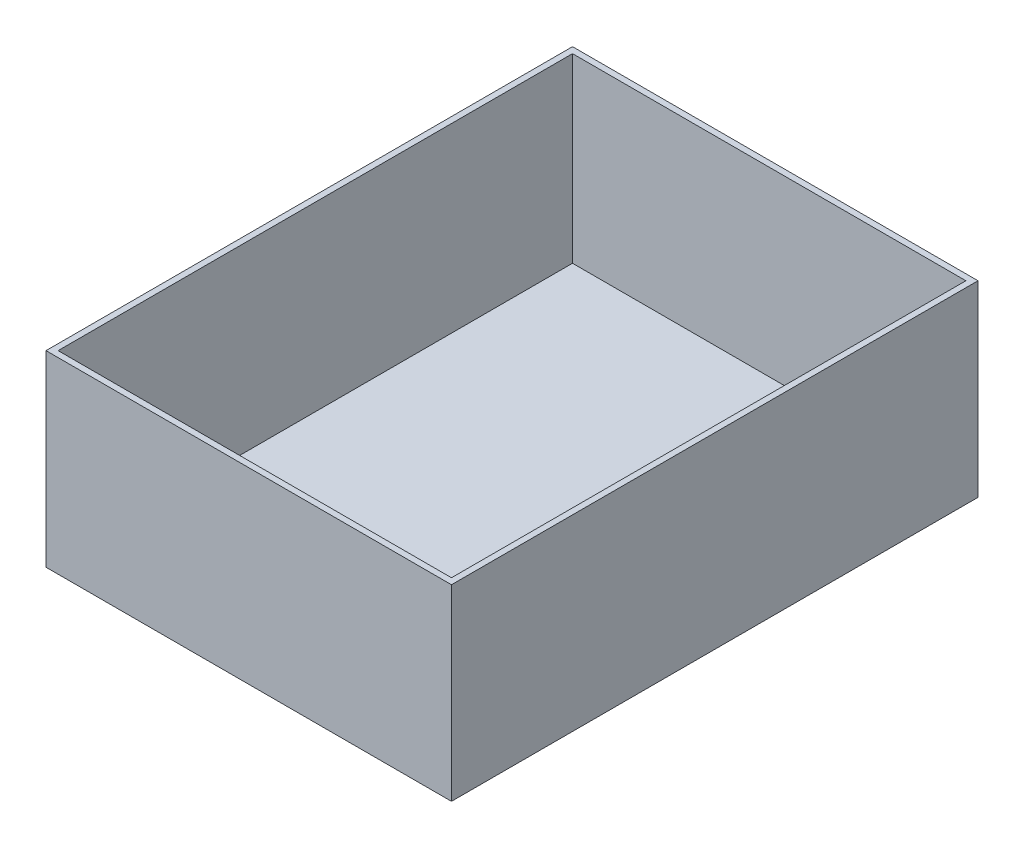
from build123d import *

# Parameters (mm, degrees)
SKETCH1_W           = 165.1
SKETCH1_H           = 215.9
BOSS_EXTRUDE1_DEPTH = 76.2
SHELL3_T            = 2.54


with BuildPart() as part:
    # Sketch1 → Boss-Extrude1 (new body)
    with BuildSketch(Plane(origin=(0, 0, 0), x_dir=(1, 0, 0), z_dir=(0, 1, 0))):
        with Locations((237.587878046, -170.22930732)):
            Rectangle(SKETCH1_W, SKETCH1_H)
    extrude(amount=BOSS_EXTRUDE1_DEPTH)

    # Shell3
    shell3_openings = [part.faces().sort_by_distance(p)[0] for p in [
        (237.587878046, 76.2, 170.22930732),
    ]]
    offset(amount=SHELL3_T, openings=shell3_openings, kind=Kind.INTERSECTION)


solid = part.part
